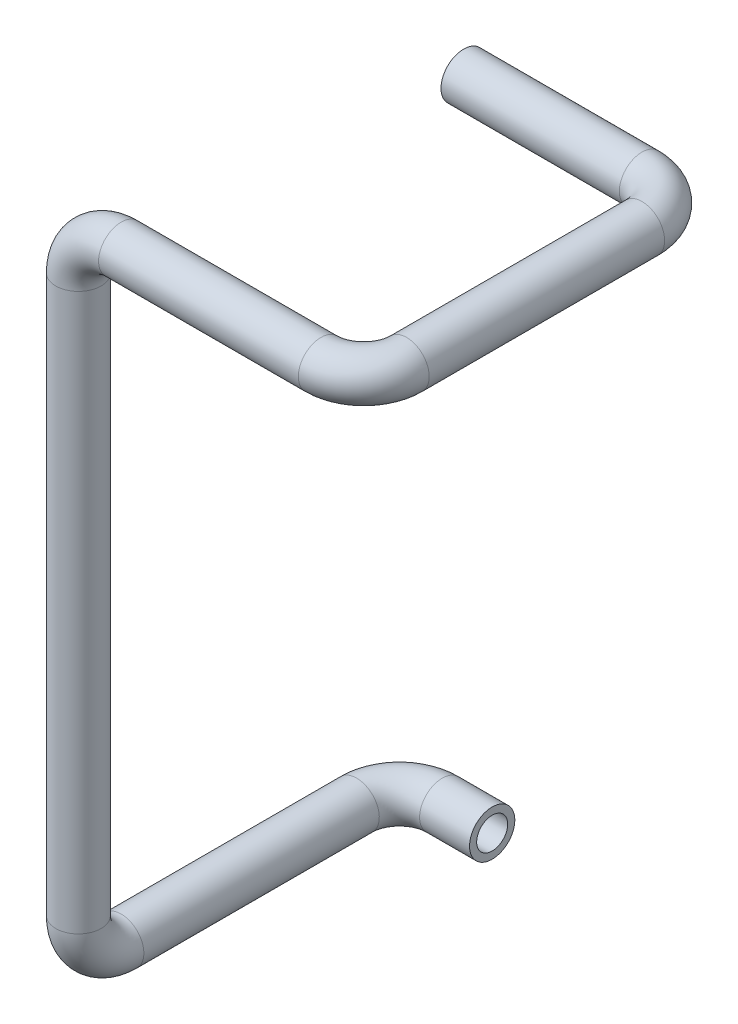
from build123d import *

# Parameters (mm, degrees)
TUBE_PROFILE_R   = 3.175
TUBE_PROFILE_R_2 = 2.175


with BuildPart() as part:
    # Tube: sweep along a curve in space
    with BuildLine() as tube_path:
        Line((163, 200, 50), (156, 200, 50))
        ThreePointArc((150, 200, 56), (151.757359313, 200, 51.757359313), (156, 200, 50))
        Line((150, 200, 56), (150, 200, 89))
        ThreePointArc((150, 206, 95), (150, 201.757359313, 93.242640687), (150, 200, 89))
        Line((150, 206, 95), (150, 284, 95))
        ThreePointArc((156, 290, 95), (151.757359313, 288.242640687, 95), (150, 284, 95))
        Line((156, 290, 95), (184, 290, 95))
        ThreePointArc((190, 290, 89), (188.242640687, 290, 93.242640687), (184, 290, 95))
        Line((190, 290, 89), (190, 290, 56))
        ThreePointArc((184, 290, 50), (188.242640687, 290, 51.757359313), (190, 290, 56))
        Line((184, 290, 50), (159, 290, 50))
    # Tube profile (on start of the path) → Tube (sweep)
    with BuildSketch(Plane(origin=(163, 200, 50), x_dir=(0, 0, -1), z_dir=(-1, 0, 0))):
        Circle(TUBE_PROFILE_R)
        Circle(TUBE_PROFILE_R_2, mode=Mode.SUBTRACT)
    sweep(path=tube_path.line)


solid = part.part
